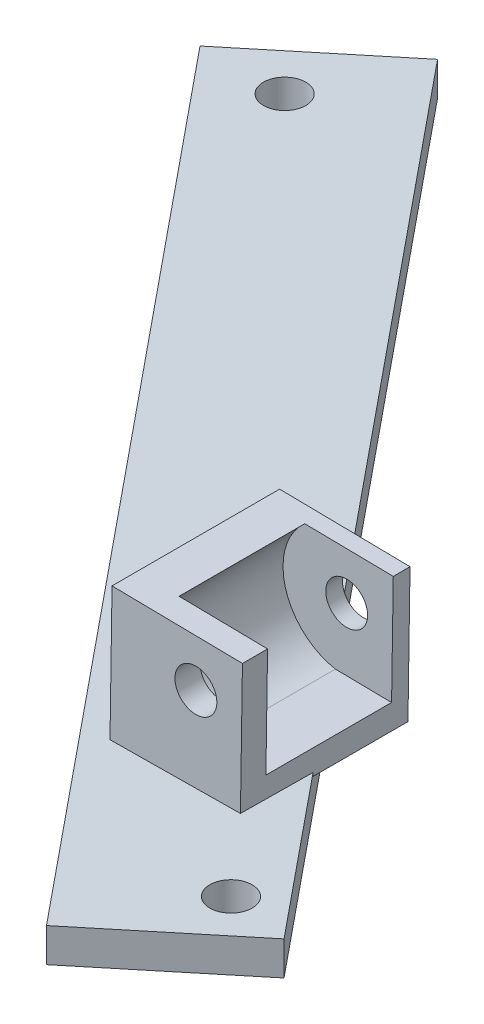
from build123d import *

# Parameters (mm, degrees)
BOSS_EXTRUDE1_DEPTH = 21.59
SKETCH2_R           = 3.175
BOSS_EXTRUDE3_DEPTH = 2.54
BOSS_EXTRUDE4_START = 3.81
SKETCH3_R           = 3.175
BOSS_EXTRUDE4_DEPTH = 3.81
SKETCH4_R           = 3.175
BOSS_EXTRUDE5_DEPTH = 5.08


with BuildPart() as part:
    # Sketch1 → Boss-Extrude1 (new body)
    with BuildSketch(Plane.XY):
        with BuildLine():
            Line((-621.150306902, 90.224895892), (-621.092144063, 94.034451914))
            Line((-621.092144063, 94.034451914), (-629.598897849, 94.164329766))
            ThreePointArc((-629.598897849, 94.164329766), (-632.210560309, 95.031876848), (-634.47123768, 96.601194079))
            ThreePointArc((-634.47123768, 96.601194079), (-637.543945735, 103.811741783), (-634.252545404, 110.925124722))
            Line((-634.252545404, 110.925124722), (-640.60180544, 111.022062787))
            Line((-640.60180544, 111.022062787), (-640.914721516, 90.52665139))
            Line((-640.914721516, 90.52665139), (-621.150306902, 90.224895892))
        make_face()
    extrude(amount=-BOSS_EXTRUDE1_DEPTH)

    # Sketch2 → Boss-Extrude3 (add)
    # profile 1 of 2: a face of its own
    with BuildSketch(Plane(origin=(0, 0, -19.05), x_dir=(-1, 0, 0), z_dir=(0, 0, -1))):
        with BuildLine():
            Line((620.837390826, 110.72030729), (621.056083102, 96.396376647))
            Line((621.056083102, 96.396376647), (634.47123768, 96.601194079))
            ThreePointArc((634.47123768, 96.601194079), (637.543945735, 103.811741783), (634.252545404, 110.925124722))
            Line((634.252545404, 110.925124722), (620.837390826, 110.72030729))
        make_face()
        with Locations(Location((627.893070479, 103.664395923, 0), (0, 0, 180))):
            Circle(SKETCH2_R, mode=Mode.SUBTRACT)
    # profile 2 of 2: a face of its own
    with BuildSketch(Plane(origin=(0, 0, -19.05), x_dir=(-1, 0, 0), z_dir=(0, 0, -1))):
        with BuildLine():
            Line((621.056083102, 96.396376647), (621.092144063, 94.034451914))
            Line((621.092144063, 94.034451914), (629.598897849, 94.164329766))
            ThreePointArc((629.598897849, 94.164329766), (632.210560309, 95.031876848), (634.47123768, 96.601194079))
            Line((634.47123768, 96.601194079), (621.056083102, 96.396376647))
        make_face()
    extrude(amount=BOSS_EXTRUDE3_DEPTH)

    # Sketch3 → Boss-Extrude4 (add)
    with BuildSketch(Plane.XY.offset(BOSS_EXTRUDE4_START)):
        Polygon((-640.60180544, 111.022062787), (-620.837390826, 110.72030729), (-621.150306902, 90.224895892), (-640.914721516, 90.52665139), align=None)
        with Locations((-627.893070479, 103.664395923)):
            Circle(SKETCH3_R, mode=Mode.SUBTRACT)
    extrude(amount=-BOSS_EXTRUDE4_DEPTH)

    # Sketch4 → Boss-Extrude5 (add)
    with BuildSketch(Plane(origin=(-1.009584834, 97.256608571, -1.08885119), x_dir=(0.9999461323694532, 0.010378769561310733, -0.00011619709707159695), z_dir=(-0.010379419992088095, 0.9998834703189057, -0.011194347843893974))):
        Polygon((-726.19647196, 95.087156462), (-619.816577451, -34.574539021), (-600.038415617, -18.347705324), (-706.418310126, 111.313990158), align=None)
        with Locations(Location((-713.367901644, 95.087156462, 0), (0, 0, 270))):
            Circle(SKETCH4_R, mode=Mode.SUBTRACT)
        with Locations(Location((-609.755864614, -16.672880145, 0), (0, 0, 270))):
            Circle(SKETCH4_R, mode=Mode.SUBTRACT)
    extrude(amount=-BOSS_EXTRUDE5_DEPTH)


solid = part.part
